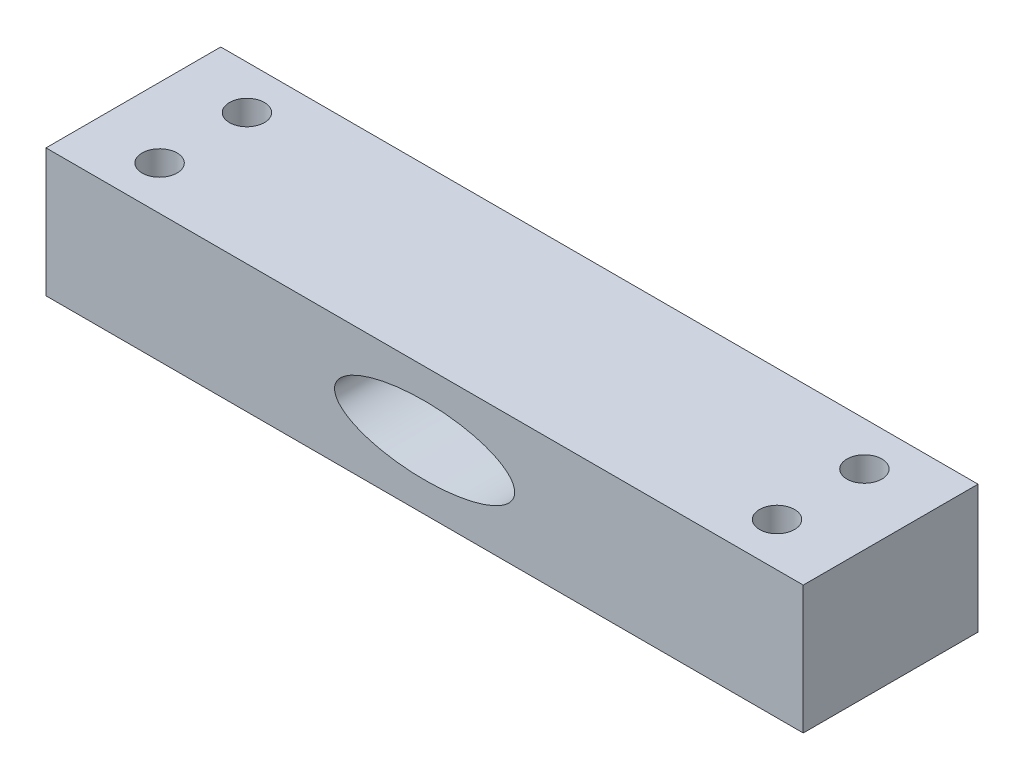
from build123d import *

# Parameters (mm, degrees)
SKETCH1_W           = 130
SKETCH1_H           = 30
BOSS_EXTRUDE1_DEPTH = 22
SKETCH2_RX          = 15.461746976
SKETCH2_RY          = 5.884694745
CUT_EXTRUDE1_DEPTH  = 75.893257373
SKETCH3_R           = 3
CUT_EXTRUDE2_DEPTH  = 71.242437461
SKETCH4_W           = 1.384926884
SKETCH4_H           = 15.203419573
CUT_EXTRUDE3_DEPTH  = 2


with BuildPart() as part:
    # Sketch1 → Boss-Extrude1 (new body)
    with BuildSketch(Plane(origin=(0, 0, 0), x_dir=(1, 0, 0), z_dir=(0, 1, 0))):
        Rectangle(SKETCH1_W, SKETCH1_H)
    extrude(amount=BOSS_EXTRUDE1_DEPTH)

    # Sketch2 → Cut-Extrude1 (cut, through all)
    with BuildSketch(Plane.XY.offset(15)):
        with Locations((0, 11)):
            Ellipse(SKETCH2_RX, SKETCH2_RY)
    extrude(amount=-CUT_EXTRUDE1_DEPTH, mode=Mode.SUBTRACT)

    # Sketch3 → Cut-Extrude2 (cut, through all)
    with BuildSketch(Plane(origin=(0, 22, 0), x_dir=(1, 0, 0), z_dir=(0, 1, 0))):
        with Locations(Location((-53, 7.5, 0), (0, 0, 270))):
            Circle(SKETCH3_R)
        with Locations(Location((53, 7.5, 0), (0, 0, 90))):
            Circle(SKETCH3_R)
        with Locations(Location((53, -7.5, 0), (0, 0, 270))):
            Circle(SKETCH3_R)
        with Locations(Location((-53, -7.5, 0), (0, 0, 90))):
            Circle(SKETCH3_R)
    extrude(amount=-CUT_EXTRUDE2_DEPTH, mode=Mode.SUBTRACT)

    # Sketch4 → Cut-Extrude3 (cut)
    with BuildSketch(Plane.ZY.offset(65)):
        with Locations((0, 9.722789651)):
            Rectangle(SKETCH4_W, SKETCH4_H)
    extrude(amount=-CUT_EXTRUDE3_DEPTH, mode=Mode.SUBTRACT)


solid = part.part
